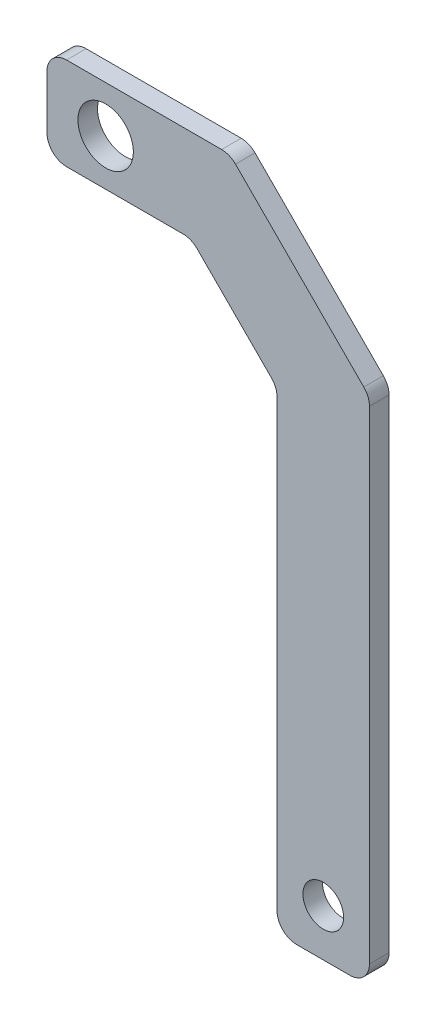
from build123d import *

# Parameters (mm, degrees)
BOSS_EXTRUDE1_DEPTH  = 3.175
M6_CLEARANCE_HOLE1_D = 6.6
FILLET1_R            = 3.175
M8_CLEARANCE_HOLE1_D = 9


with BuildPart() as part:
    # Sketch2 → Boss-Extrude1 (new body)
    with BuildSketch(Plane.XY):
        Polygon((-136.187872738, 122.986389998), (-136.187872738, 198.242289047), (-158.863157835, 221.01860883), (-179.00393221, 221.01860883), (-188.52893221, 221.01860883), (-188.52893221, 206.01860883), (-179.00393221, 206.01860883), (-151.187872738, 206.01860883), (-151.187872738, 122.986389998), (-151.187872738, 115.366389998), (-136.187872738, 115.366389998), align=None)
        Polygon((-151.187872738, 206.01860883), (-165.095902474, 206.01860883), (-151.187872738, 192.04860883), align=None)
    extrude(amount=BOSS_EXTRUDE1_DEPTH)

    # M6 Clearance Hole1 (through all)
    with Locations(Plane.XY.offset(3.175)):
        with Locations((-143.687872738, 122.986389998)):
            Hole(M6_CLEARANCE_HOLE1_D / 2)

    # Fillet1
    fillet1_edges = [part.edges().sort_by_distance(p)[0] for p in [
        (-188.52893221, 206.01860883, 1.5875),
        (-188.52893221, 221.01860883, 1.5875),
        (-158.863157835, 221.01860883, 1.5875),
        (-136.187872738, 198.242289047, 1.5875),
        (-136.187872738, 115.366389998, 1.5875),
        (-151.187872738, 115.366389998, 1.5875),
        (-151.187872738, 192.04860883, 1.5875),
        (-165.095902474, 206.01860883, 1.5875),
    ]]
    fillet(fillet1_edges, radius=FILLET1_R)

    # M8 Clearance Hole1 (through all)
    with Locations(Plane.XY.offset(3.175)):
        with Locations((-179.00393221, 213.51860883)):
            Hole(M8_CLEARANCE_HOLE1_D / 2)


solid = part.part
